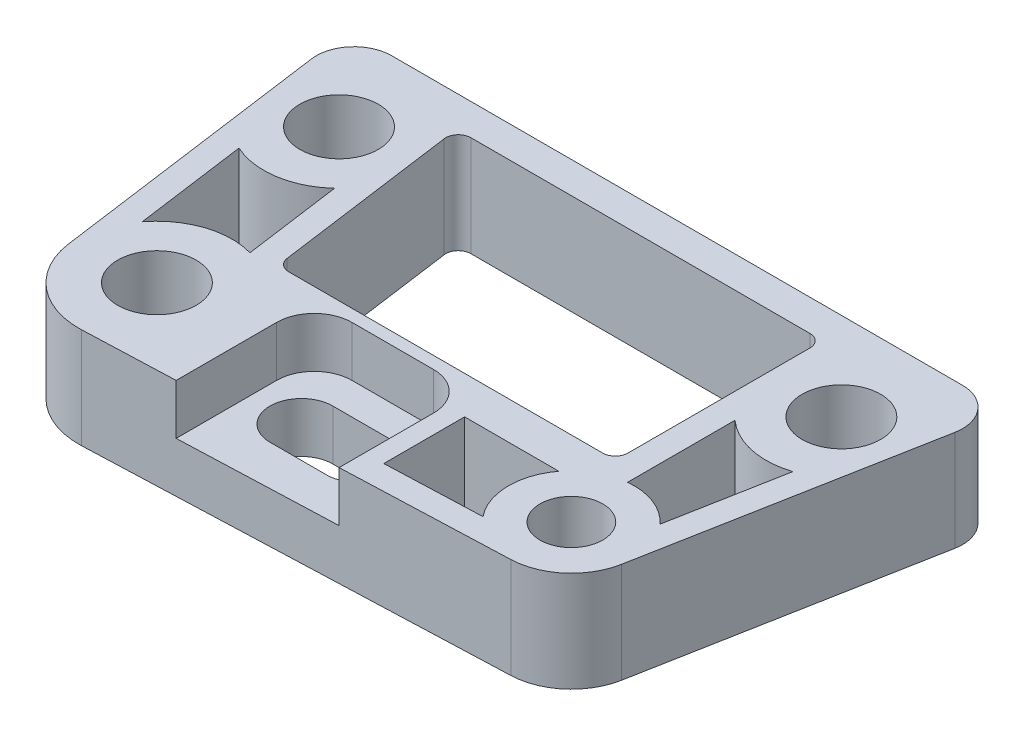
from build123d import *

# Parameters (mm, degrees)
SKETCH3_R           = 3.96875
SKETCH3_R_2         = 3.175
BOSS_EXTRUDE4_DEPTH = 10.16
CUT_EXTRUDE3_DEPTH  = 5.08
FILLET1_R           = 3.81


with BuildPart() as part:
    # Sketch3 → Boss-Extrude4 (new body)
    with BuildSketch(Plane(origin=(0, 0, 0), x_dir=(1, 0, 0), z_dir=(0, 1, 0))):
        with BuildLine():
            Line((54.2925, 31.75), (-12.3825, 31.75))
            Line((-12.3825, 31.75), (-7.863361559, -1.082336008))
            ThreePointArc((-7.863361559, -1.082336008), (-5.101706023, -6.080830692), (0.300662879, -7.931803583))
            Line((0.300662879, -7.931803583), (42.150530303, -6.345442867))
            ThreePointArc((42.150530303, -6.345442867), (46.059378881, -4.806782177), (48.152310263, -1.164501002))
            Line((48.152310263, -1.164501002), (54.2925, 31.75))
        make_face()
        Circle(SKETCH3_R, mode=Mode.SUBTRACT)
        with Locations((-4.445, 22.86)):
            Circle(SKETCH3_R, mode=Mode.SUBTRACT)
        with Locations((46.355, 22.86)):
            Circle(SKETCH3_R, mode=Mode.SUBTRACT)
        with Locations((41.91, 0)):
            Circle(SKETCH3_R_2, mode=Mode.SUBTRACT)
        with BuildLine():
            Line((38.735, 8.89), (38.735, 27.305))
            ThreePointArc((38.735, 27.305), (38.363025612, 28.203025612), (37.465, 28.575))
            Line((37.465, 28.575), (3.175, 28.575))
            ThreePointArc((3.175, 28.575), (2.217704153, 28.139556566), (1.91686215, 27.131826239))
            Line((1.91686215, 27.131826239), (4.451556434, 8.716826239))
            ThreePointArc((4.451556434, 8.716826239), (4.875137717, 7.932704153), (5.709694283, 7.62))
            Line((5.709694283, 7.62), (37.465, 7.62))
            ThreePointArc((37.465, 7.62), (38.363025612, 7.991974388), (38.735, 8.89))
        make_face(mode=Mode.SUBTRACT)
        with BuildLine():
            Line((20.32, 3.175), (14.605, 3.175))
            ThreePointArc((14.605, 3.175), (11.43, 0), (14.605, -3.175))
            Line((14.605, -3.175), (20.32, -3.175))
            ThreePointArc((20.32, -3.175), (22.498043553, -2.310140965), (23.489504023, -0.186733089))
            Line((23.489504023, -0.186733089), (21.228562514, 3.04222602))
            ThreePointArc((21.228562514, 3.04222602), (20.779106407, 3.141631154), (20.32, 3.175))
        make_face(mode=Mode.SUBTRACT)
        with BuildLine():
            Line((46.58698696, 4.295147609), (48.697586564, 15.60902157))
            ThreePointArc((48.697586564, 15.60902157), (44.776818872, 15.405220035), (41.275, 17.180387337))
            Line((41.275, 17.180387337), (41.275, 6.318170226))
            ThreePointArc((41.275, 6.318170226), (44.169993312, 5.934216901), (46.58698696, 4.295147609))
        make_face(mode=Mode.SUBTRACT)
        with BuildLine():
            Line((-6.080523252, 4.592563226), (-7.642900683, 15.943510195))
            ThreePointArc((-7.642900683, 15.943510195), (-3.266927549, 15.331617352), (0.712930912, 17.251065278))
            Line((0.712930912, 17.251065278), (2.078345222, 7.331090037))
            ThreePointArc((2.078345222, 7.331090037), (-2.424714317, 7.223929712), (-6.080523252, 4.592563226))
        make_face(mode=Mode.SUBTRACT)
        with BuildLine():
            Line((36.977963889, -3.999689962), (27.305, -4.366353249))
            Line((27.305, -4.366353249), (27.305, 3.81))
            Line((27.305, 3.81), (36.83, 3.81))
            ThreePointArc((36.83, 3.81), (35.561139386, -0.120286735), (36.977963889, -3.999689962))
        make_face(mode=Mode.SUBTRACT)
    extrude(amount=BOSS_EXTRUDE4_DEPTH)

    # Sketch5 → Cut-Extrude3 (cut)
    with BuildSketch(Plane(origin=(0, 10.16, 0), x_dir=(1, 0, 0), z_dir=(0, 1, 0))):
        with BuildLine():
            Line((25.4, 2.577854061), (25.4, -7.582145939))
            Line((25.4, -7.582145939), (9.525, -7.582145939))
            Line((9.525, -7.582145939), (9.525, 2.577854061))
            ThreePointArc((9.525, 2.577854061), (10.640923164, 5.271930897), (13.335, 6.387854061))
            Line((13.335, 6.387854061), (21.59, 6.387854061))
            ThreePointArc((21.59, 6.387854061), (24.284076836, 5.271930897), (25.4, 2.577854061))
        make_face()
    extrude(amount=-CUT_EXTRUDE3_DEPTH, mode=Mode.SUBTRACT)

    # Fillet1
    fillet1_edges = [part.edges().sort_by_distance(p)[0] for p in [
        (-12.3825, 5.08, -31.75),
        (54.2925, 5.08, -31.75),
    ]]
    fillet(fillet1_edges, radius=FILLET1_R)


solid = part.part
